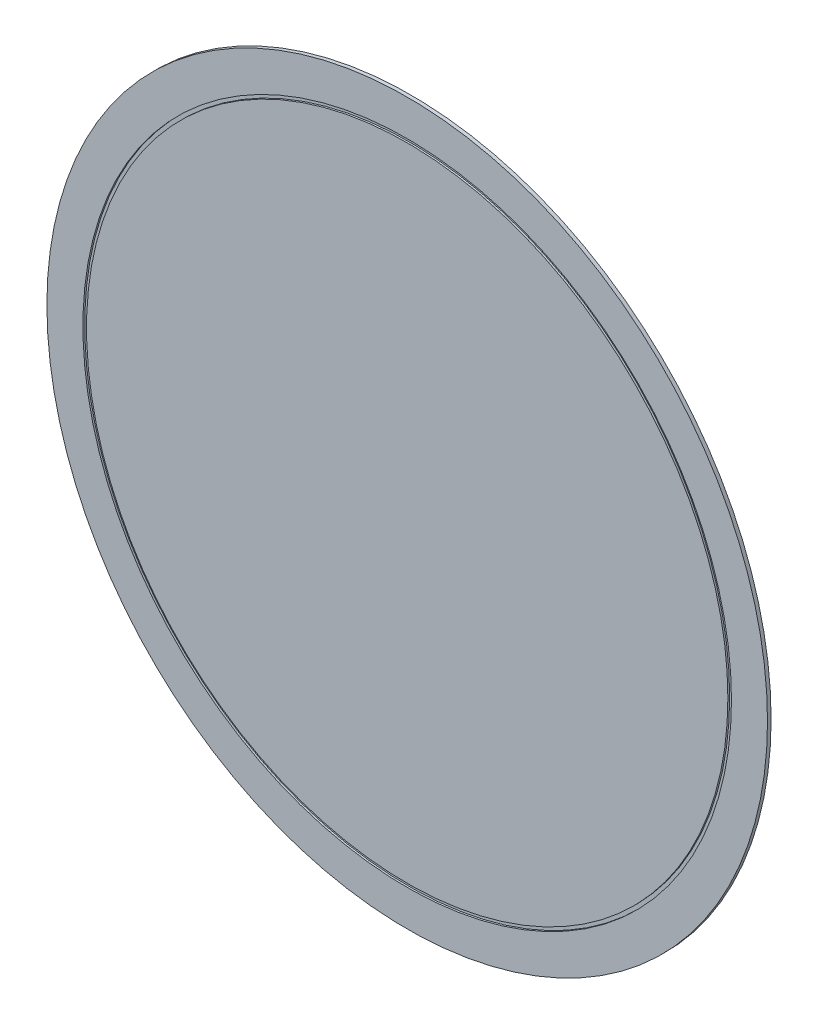
from build123d import *

# Parameters (mm, degrees)
SKETCH1_R           = 254
BOSS_EXTRUDE1_DEPTH = 2.54
SKETCH2_R           = 228.6
SKETCH2_R_2         = 226.06
CUT_EXTRUDE1_DEPTH  = 1.27


with BuildPart() as part:
    # Sketch1 → Boss-Extrude1 (new body)
    with BuildSketch(Plane.XY):
        Circle(SKETCH1_R)
    extrude(amount=BOSS_EXTRUDE1_DEPTH)

    # Sketch2 → Cut-Extrude1 (cut)
    with BuildSketch(Plane.XY.offset(2.54)):
        Circle(SKETCH2_R)
        Circle(SKETCH2_R_2, mode=Mode.SUBTRACT)
    extrude(amount=-CUT_EXTRUDE1_DEPTH, mode=Mode.SUBTRACT)


solid = part.part
